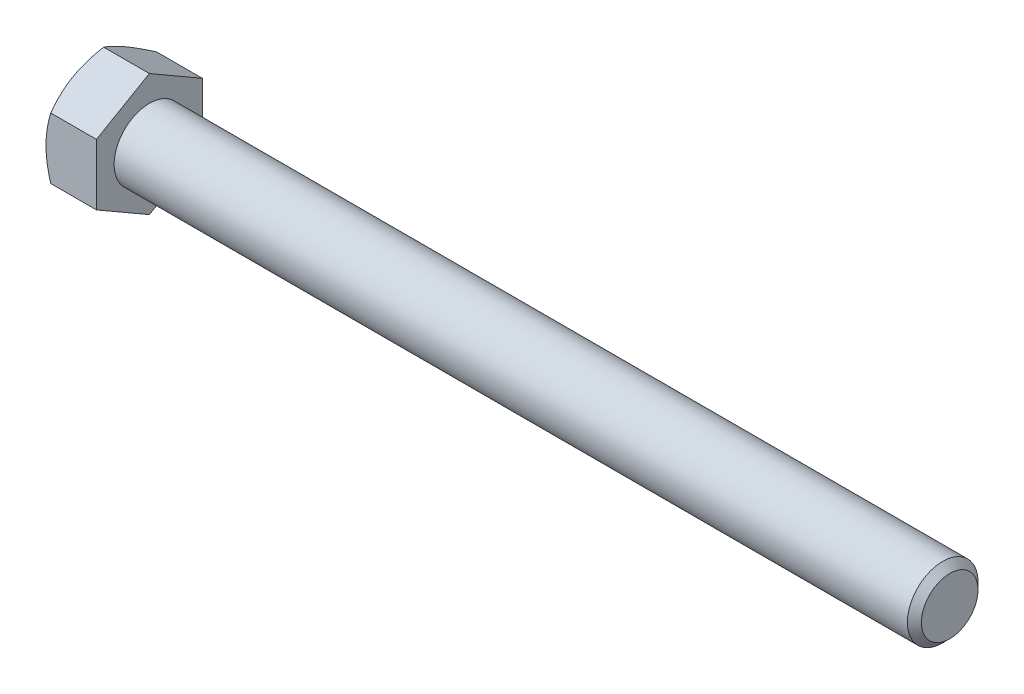
from build123d import *

# Parameters (mm, degrees)
BASEHEAD_DEPTH = 6.8072


with BuildPart() as part:
    # Sketch1 → BaseHead (new body)
    with BuildSketch(Plane(origin=(0, 0, 0), x_dir=(0, 0, -1), z_dir=(1, 0, 0))):
        Polygon((7.1374, 4.120779811), (7.1374, -4.120779811), (0, -8.241559623), (-7.1374, -4.120779811), (-7.1374, 4.120779811), (0, 8.241559623), align=None)
    extrude(amount=BASEHEAD_DEPTH)

    # BodySke → BaseBody (revolve)
    with BuildSketch(Plane.XY, mode=Mode.PRIVATE) as basebody_sk:
        Polygon((0, 0), (114.7572, 0), (114.7572, 3.81635), (113.81105, 4.7625), (0, 4.7625), align=None)
    revolve(basebody_sk.sketch.rotate(Axis((0, 0, 0), (1, 0, 0)), 90), axis=Axis((0, 0, 0), (1, 0, 0)))

    # Sketch3 → HeadChamfer (revolve, cut)
    with BuildSketch(Plane.XY):
        Polygon((0, 7.1374), (4.303661065, 14.591559623), (4.303661065, 20.941559623), (-12.7, 20.941559623), (-12.7, 7.1374), align=None)
    revolve(axis=Axis((0, 0, 0), (1, 0, 0)), mode=Mode.SUBTRACT)


solid = part.part
